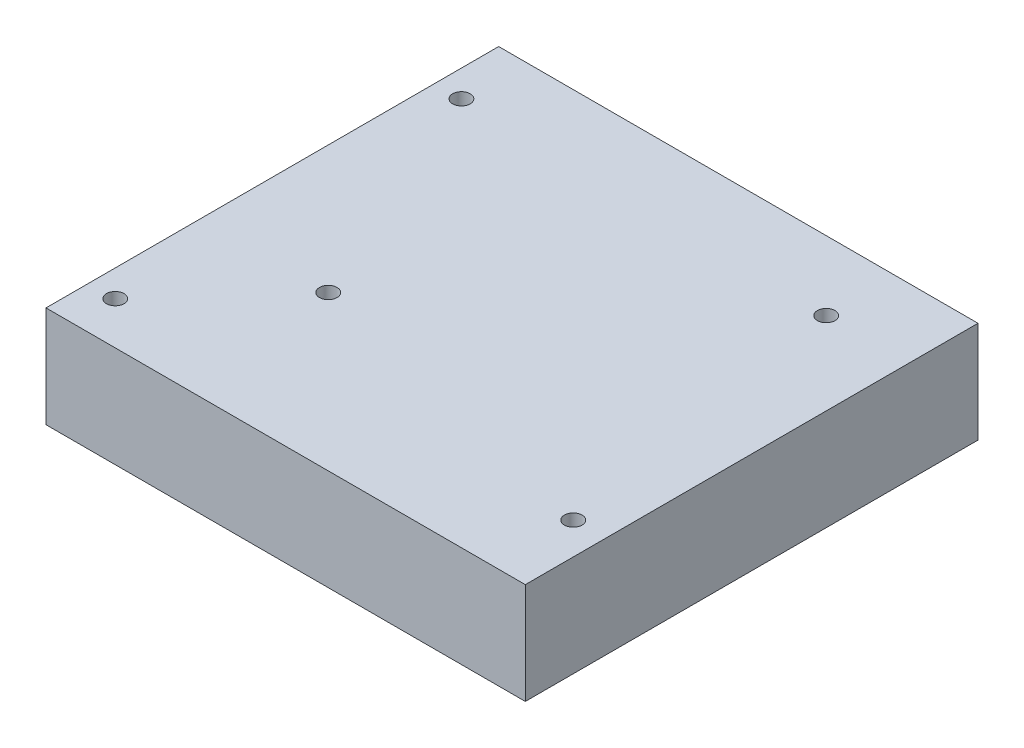
from build123d import *

# Parameters (mm, degrees)
SKETCH1_W           = 90
SKETCH1_H           = 85
SKETCH1_R           = 1.65
BOSS_EXTRUDE1_DEPTH = 19


with BuildPart() as part:
    # Sketch1 → Boss-Extrude1 (new body)
    with BuildSketch(Plane(origin=(0, 0, 0), x_dir=(1, 0, 0), z_dir=(0, 1, 0))):
        with Locations((45, 42.5)):
            Rectangle(SKETCH1_W, SKETCH1_H)
        with Locations(Location((5, 73, 0), (0, 0, 270))):
            Circle(SKETCH1_R, mode=Mode.SUBTRACT)
        with Locations(Location((5, 8, 0), (0, 0, 270))):
            Circle(SKETCH1_R, mode=Mode.SUBTRACT)
        with Locations(Location((84, 15, 0), (0, 0, 270))):
            Circle(SKETCH1_R, mode=Mode.SUBTRACT)
        with Locations(Location((24, 29, 0), (0, 0, 270))):
            Circle(SKETCH1_R, mode=Mode.SUBTRACT)
        with Locations(Location((74.5, 72, 0), (0, 0, 270))):
            Circle(SKETCH1_R, mode=Mode.SUBTRACT)
    extrude(amount=BOSS_EXTRUDE1_DEPTH)


solid = part.part
